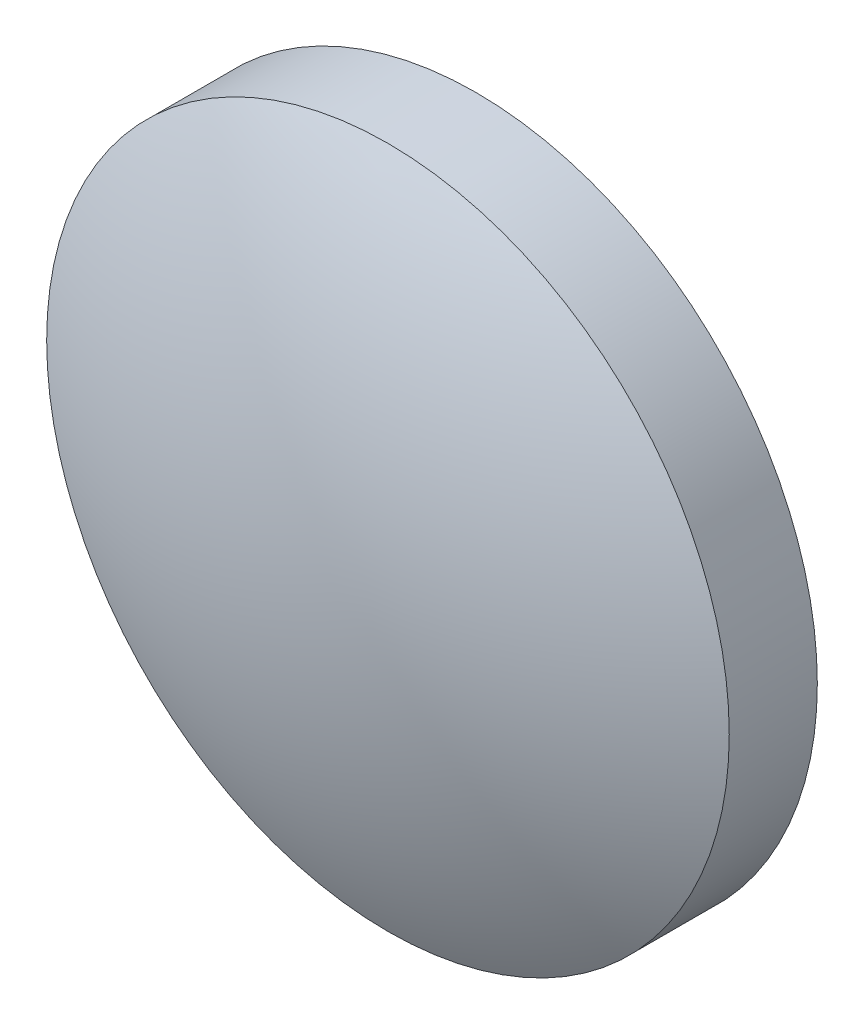
from build123d import *


with BuildPart() as part:
    # Sketch3 → Revolve1 (revolve)
    with BuildSketch(Plane(origin=(0, 0, 0), x_dir=(0, 0, -1), z_dir=(1, 0, 0))):
        with BuildLine():
            Line((0, 3.875), (0, 0))
            Line((0, 0), (1.442764019, 0))
            ThreePointArc((1.442764019, 0), (1.203684818, 1.994017866), (0.5, 3.875))
            Line((0.5, 3.875), (0, 3.875))
        make_face()
        with BuildLine():
            ThreePointArc((-0.5, 3.875), (-1.203684818, 1.994017866), (-1.442764019, 0))
            Line((-1.442764019, 0), (0, 0))
            Line((0, 0), (0, 3.875))
            Line((0, 3.875), (-0.5, 3.875))
        make_face()
    revolve(axis=Axis((0, 0, 0), (0, 0, 1)))


solid = part.part
